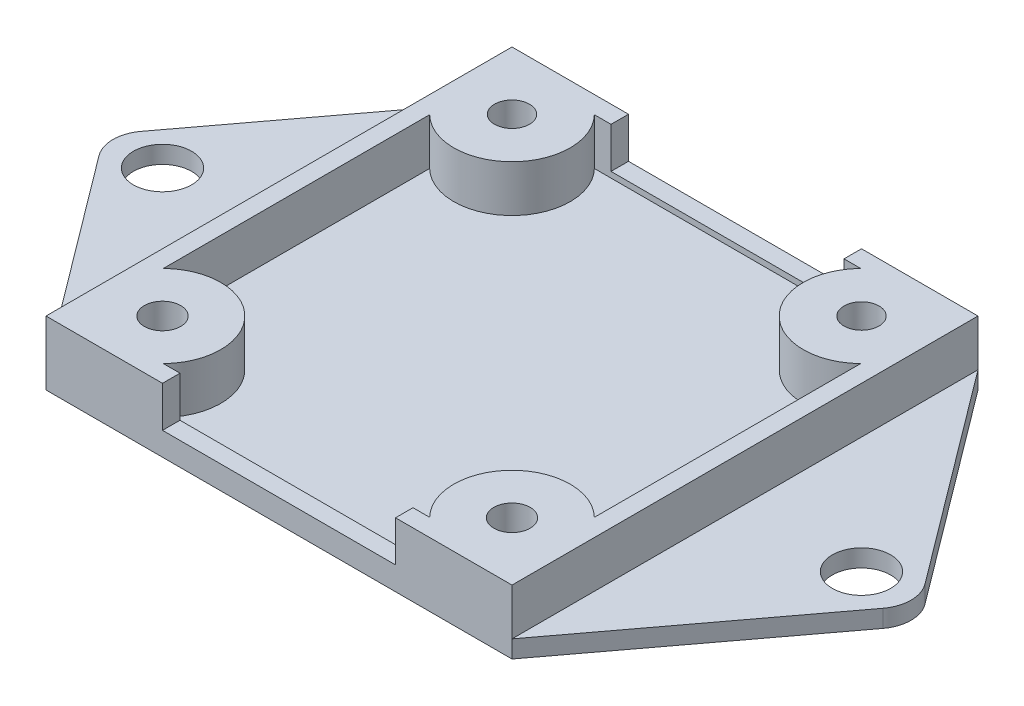
from build123d import *

# Parameters (mm, degrees)
SKETCH1_R           = 1.5
SKETCH1_R_2         = 2.5
BOSS_EXTRUDE1_DEPTH = 1.5
SKETCH2_W           = 40
SKETCH2_H           = 40
SKETCH2_R           = 1.5
SKETCH2_R_2         = 1.558204887
BOSS_EXTRUDE2_DEPTH = 4
SKETCH3_W           = 20
SKETCH3_H           = 3.5
CUT_EXTRUDE1_DEPTH  = 2
SKETCH4_W           = 20
SKETCH4_H           = 3.5
CUT_EXTRUDE2_DEPTH  = 2
FILLET1_R           = 3


with BuildPart() as part:
    # Sketch1 → Boss-Extrude1 (new body)
    with BuildSketch(Plane(origin=(0, 0, 0), x_dir=(1, 0, 0), z_dir=(0, 1, 0))):
        Polygon((-20, 20), (20, 20), (35, 0), (20, -20), (-20, -20), (-35, 0), align=None)
        with Locations(Location((-15, 15, 0), (0, 0, 270))):
            Circle(SKETCH1_R, mode=Mode.SUBTRACT)
        with Locations(Location((15, 15, 0), (0, 0, 270))):
            Circle(SKETCH1_R, mode=Mode.SUBTRACT)
        with Locations(Location((15, -15, 0), (0, 0, 90))):
            Circle(SKETCH1_R, mode=Mode.SUBTRACT)
        with Locations(Location((-15, -15, 0), (0, 0, 90))):
            Circle(SKETCH1_R, mode=Mode.SUBTRACT)
        with Locations(Location((-30, 0, 0), (0, 0, 270))):
            Circle(SKETCH1_R_2, mode=Mode.SUBTRACT)
        with Locations(Location((30, 0, 0), (0, 0, 90))):
            Circle(SKETCH1_R_2, mode=Mode.SUBTRACT)
    extrude(amount=BOSS_EXTRUDE1_DEPTH)

    # Sketch2 → Boss-Extrude2 (add)
    with BuildSketch(Plane(origin=(0, 1.5, 0), x_dir=(1, 0, 0), z_dir=(0, 1, 0))):
        Rectangle(SKETCH2_W, SKETCH2_H)
        with Locations(Location((-15, 15, 0), (0, 0, 270))):
            Circle(SKETCH2_R, mode=Mode.SUBTRACT)
        with Locations(Location((15, -15, 0), (0, 0, 270))):
            Circle(SKETCH2_R_2, mode=Mode.SUBTRACT)
        with Locations(Location((-15, -15, 0), (0, 0, 90))):
            Circle(SKETCH2_R_2, mode=Mode.SUBTRACT)
        with Locations(Location((15, 15, 0), (0, 0, 90))):
            Circle(SKETCH2_R, mode=Mode.SUBTRACT)
        with BuildLine():
            Line((-18.5, 11.429285786), (-18.5, -11.429285786))
            ThreePointArc((-18.5, -11.429285786), (-11.464466094, -11.464466094), (-11.429285786, -18.5))
            Line((-11.429285786, -18.5), (11.429285786, -18.5))
            ThreePointArc((11.429285786, -18.5), (11.464466094, -11.464466094), (18.5, -11.429285786))
            Line((18.5, -11.429285786), (18.5, 11.429285786))
            ThreePointArc((18.5, 11.429285786), (11.464466094, 11.464466094), (11.429285786, 18.5))
            Line((11.429285786, 18.5), (-11.429285786, 18.5))
            ThreePointArc((-11.429285786, 18.5), (-11.464466094, 11.464466094), (-18.5, 11.429285786))
        make_face(mode=Mode.SUBTRACT)
    extrude(amount=BOSS_EXTRUDE2_DEPTH)

    # Sketch3 → Cut-Extrude1 (cut)
    with BuildSketch(Plane.XY.offset(20)):
        with Locations((0, 3.75)):
            Rectangle(SKETCH3_W, SKETCH3_H)
    extrude(amount=-CUT_EXTRUDE1_DEPTH, mode=Mode.SUBTRACT)

    # Sketch4 → Cut-Extrude2 (cut)
    with BuildSketch(Plane(origin=(0, 0, -20), x_dir=(-1, 0, 0), z_dir=(0, 0, -1))):
        with Locations((0, 3.75)):
            Rectangle(SKETCH4_W, SKETCH4_H)
    extrude(amount=-CUT_EXTRUDE2_DEPTH, mode=Mode.SUBTRACT)

    # Fillet1
    fillet1_edges = [part.edges().sort_by_distance(p)[0] for p in [
        (-35, 0.75, 0),
        (35, 0.75, 0),
    ]]
    fillet(fillet1_edges, radius=FILLET1_R)


solid = part.part
